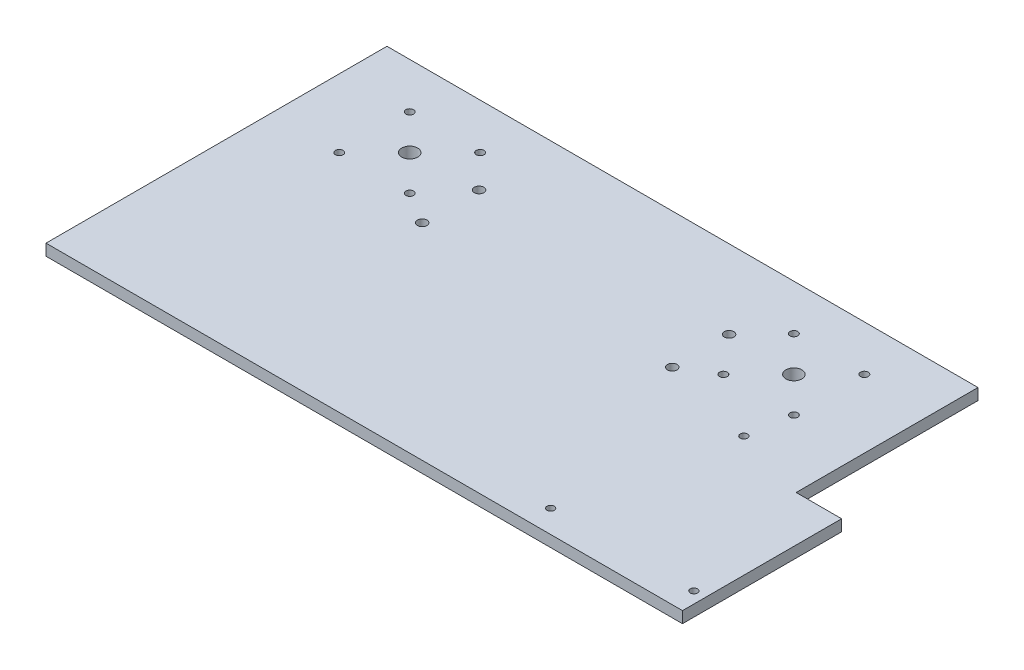
from build123d import *

# Parameters (mm, degrees)
SKETCH_1_R      = 1.6
SKETCH_1_R_2    = 1.7
SKETCH_1_R_3    = 2.1
SKETCH_1_R_4    = 3.5
EXTRUDE_1_DEPTH = 5


with BuildPart() as part:
    # 草图1 → 凸台-拉伸1 (new body)
    with BuildSketch(Plane(origin=(0, 0, 0), x_dir=(1, 0, 0), z_dir=(0, 1, 0))):
        Polygon((-140, 75), (-140, -75), (140, -75), (140, -5), (120, -5), (120, 75), align=None)
        with Locations(Location((72, -65, 0), (0, 0, 270))):
            Circle(SKETCH_1_R, mode=Mode.SUBTRACT)
        with Locations(Location((135, -65, 0), (0, 0, 270))):
            Circle(SKETCH_1_R, mode=Mode.SUBTRACT)
        with Locations(Location((-110, 24, 0), (0, 0, 270))):
            Circle(SKETCH_1_R_2, mode=Mode.SUBTRACT)
        with Locations(Location((-79, 24, 0), (0, 0, 270))):
            Circle(SKETCH_1_R_2, mode=Mode.SUBTRACT)
        with Locations(Location((-65, 15.5, 0), (0, 0, 270))):
            Circle(SKETCH_1_R_3, mode=Mode.SUBTRACT)
        with Locations(Location((-110, 55, 0), (0, 0, 270))):
            Circle(SKETCH_1_R_2, mode=Mode.SUBTRACT)
        with Locations(Location((-94.5, 39.5, 0), (0, 0, 270))):
            Circle(SKETCH_1_R_4, mode=Mode.SUBTRACT)
        with Locations(Location((-79, 55, 0), (0, 0, 270))):
            Circle(SKETCH_1_R_2, mode=Mode.SUBTRACT)
        with Locations(Location((-65, 40.5, 0), (0, 0, 270))):
            Circle(SKETCH_1_R_3, mode=Mode.SUBTRACT)
        with Locations(Location((45, 15.5, 0), (0, 0, 270))):
            Circle(SKETCH_1_R_3, mode=Mode.SUBTRACT)
        with Locations(Location((59, 24, 0), (0, 0, 270))):
            Circle(SKETCH_1_R_2, mode=Mode.SUBTRACT)
        with Locations(Location((87, 5, 0), (0, 0, 270))):
            Circle(SKETCH_1_R, mode=Mode.SUBTRACT)
        with Locations(Location((90, 24, 0), (0, 0, 270))):
            Circle(SKETCH_1_R_2, mode=Mode.SUBTRACT)
        with Locations(Location((45, 40.5, 0), (0, 0, 270))):
            Circle(SKETCH_1_R_3, mode=Mode.SUBTRACT)
        with Locations(Location((59, 55, 0), (0, 0, 270))):
            Circle(SKETCH_1_R_2, mode=Mode.SUBTRACT)
        with Locations(Location((74.5, 39.5, 0), (0, 0, 270))):
            Circle(SKETCH_1_R_4, mode=Mode.SUBTRACT)
        with Locations(Location((90, 55, 0), (0, 0, 270))):
            Circle(SKETCH_1_R_2, mode=Mode.SUBTRACT)
    extrude(amount=EXTRUDE_1_DEPTH)


solid = part.part
